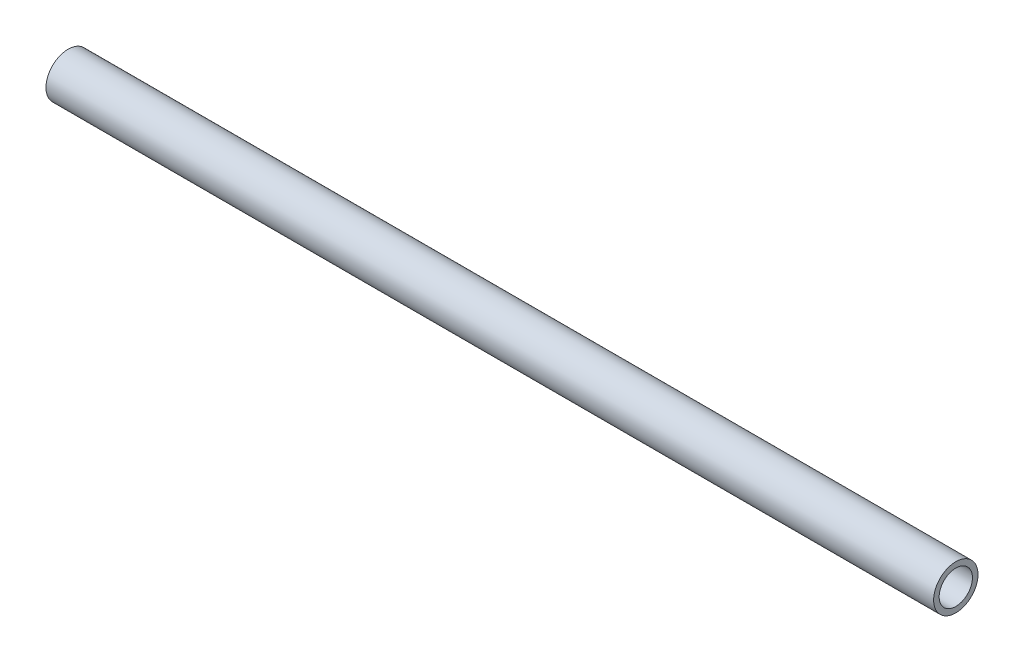
from build123d import *

# Parameters (mm, degrees)
SKETCH1_R          = 12.7
SKETCH1_R_2        = 9.525
EXTRUDE1_DEPTH     = 457.2
SKETCH3_R          = 12.7
SKETCH3_R_2        = 9.525
CUT_EXTRUDE1_DEPTH = 406.4


with BuildPart() as part:
    # Sketch1 → Extrude1 (new, symmetric)
    with BuildSketch(Plane(origin=(0, 0, 0), x_dir=(0, 0, -1), z_dir=(1, 0, 0))):
        Circle(SKETCH1_R)
        Circle(SKETCH1_R_2, mode=Mode.SUBTRACT)
    extrude(amount=EXTRUDE1_DEPTH, both=True)

    # Sketch3 → Cut-Extrude1 (cut)
    with BuildSketch(Plane.ZY.offset(457.2)):
        with Locations(Location((0, 0, 0), (0, 0, 180))):
            Circle(SKETCH3_R)
        with Locations(Location((0, 0, 0), (0, 0, 180))):
            Circle(SKETCH3_R_2, mode=Mode.SUBTRACT)
    extrude(amount=-CUT_EXTRUDE1_DEPTH, mode=Mode.SUBTRACT)


solid = part.part
